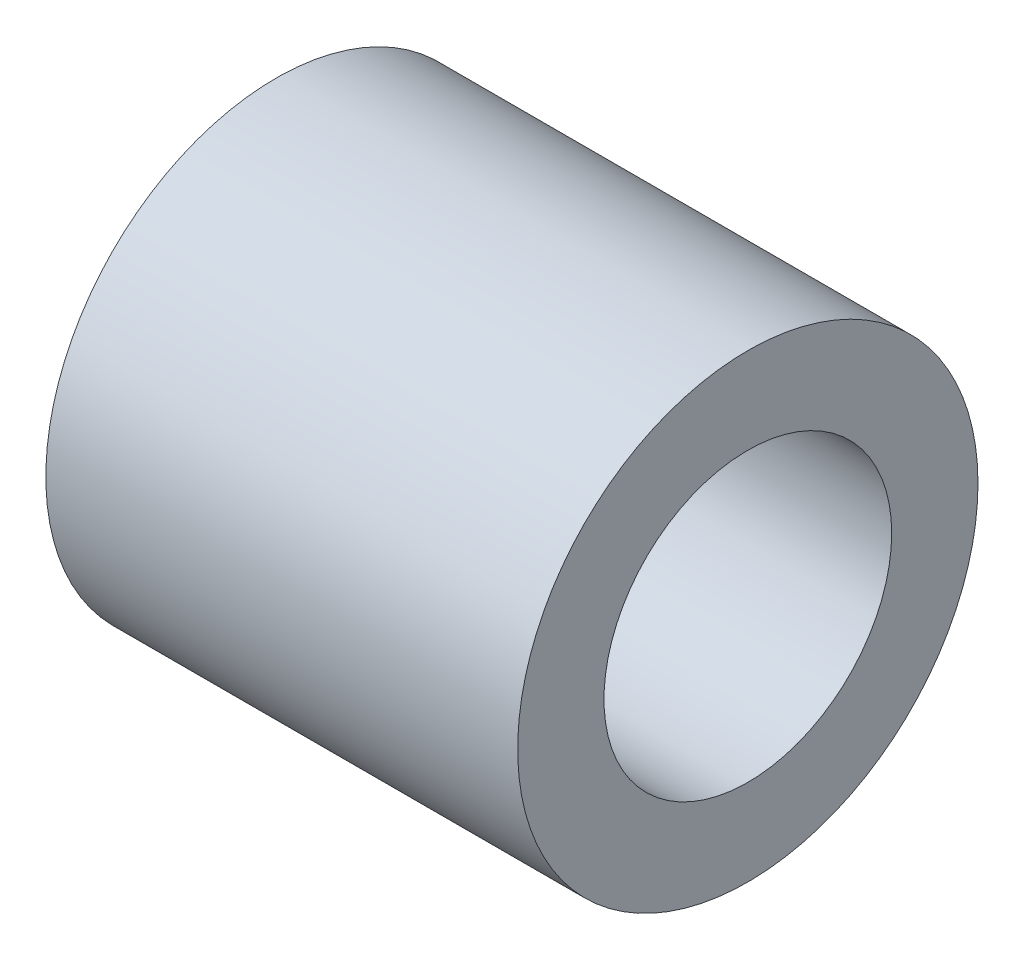
from build123d import *

# Parameters (mm, degrees)
SKETCH1_R           = 4
SKETCH1_R_2         = 2.5
BOSS_EXTRUDE1_DEPTH = 8.2


with BuildPart() as part:
    # Sketch1 → Boss-Extrude1 (new body)
    with BuildSketch(Plane(origin=(0, 0, 0), x_dir=(0, 0, -1), z_dir=(1, 0, 0))):
        Circle(SKETCH1_R)
        Circle(SKETCH1_R_2, mode=Mode.SUBTRACT)
    extrude(amount=BOSS_EXTRUDE1_DEPTH)


solid = part.part
